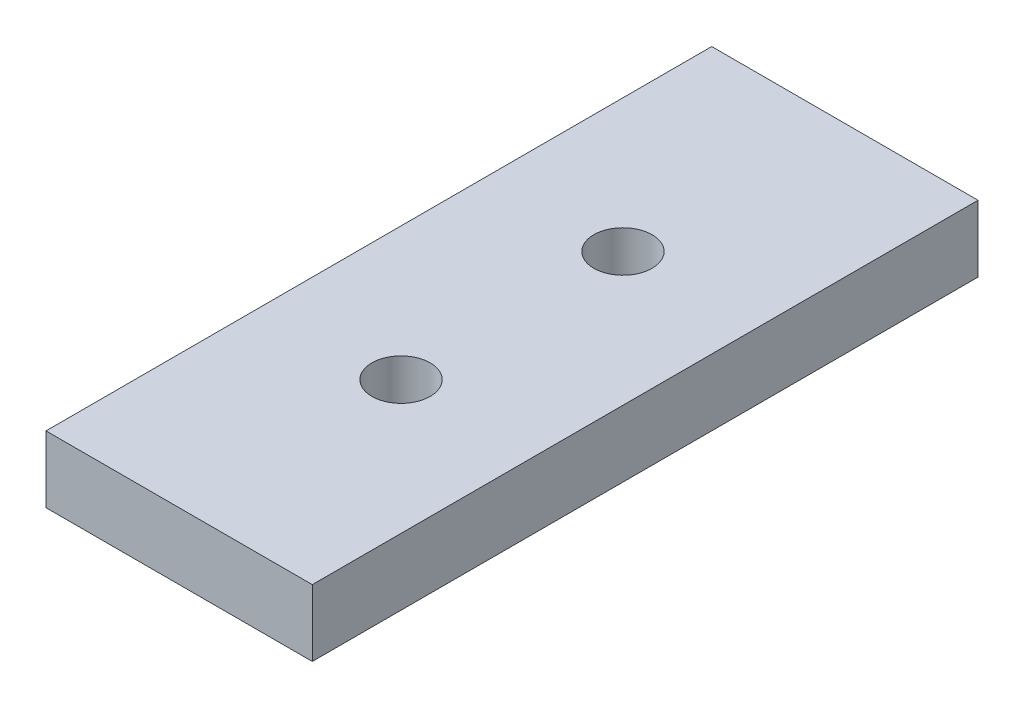
from build123d import *

# Parameters (mm, degrees)
SKETCH1_W           = 25.4
SKETCH1_H           = 63.5
BOSS_EXTRUDE2_DEPTH = 6.35
SKETCH3_R           = 2.778125
CUT_EXTRUDE1_DEPTH  = 69.685751798


with BuildPart() as part:
    # Sketch1 → Boss-Extrude2 (new body)
    with BuildSketch(Plane(origin=(0, 0, 0), x_dir=(1, 0, 0), z_dir=(0, 1, 0))):
        with Locations((-12.7, 31.75)):
            Rectangle(SKETCH1_W, SKETCH1_H)
    extrude(amount=-BOSS_EXTRUDE2_DEPTH)

    # Sketch3 → Cut-Extrude1 (cut, through all)
    with BuildSketch(Plane(origin=(0, 0, 0), x_dir=(1, 0, 0), z_dir=(0, 1, 0))):
        with Locations(Location((-12.7, 21.166666667, 0), (0, 0, 270))):
            Circle(SKETCH3_R)
        with Locations(Location((-12.7, 42.333333333, 0), (0, 0, 270))):
            Circle(SKETCH3_R)
    extrude(amount=-CUT_EXTRUDE1_DEPTH, mode=Mode.SUBTRACT)


solid = part.part
